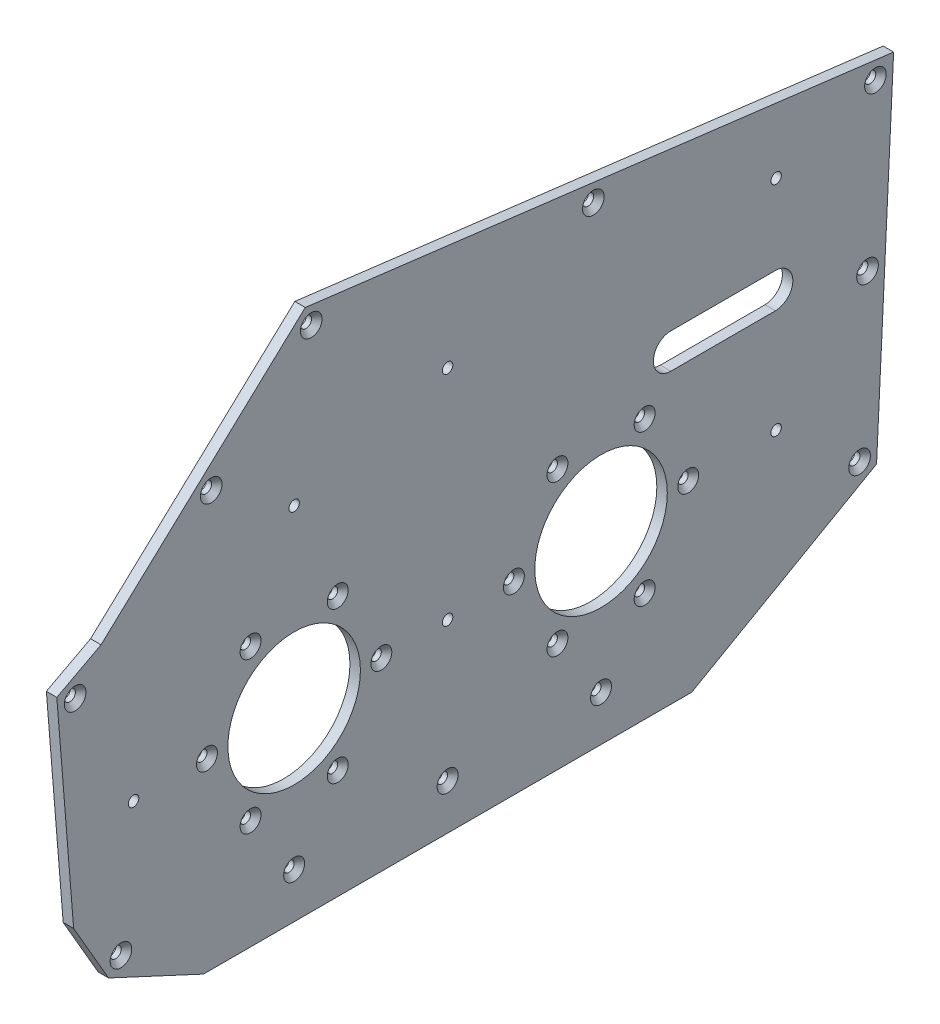
from build123d import *

# Parameters (mm, degrees)
SKETCH_1_R          = 19
SKETCH_1_R_2        = 1.5
EXTRUDE_1_DEPTH     = 3
CUT_EXTRUDE_1_DEPTH = 77
CHAMFER_1_SIZE      = 1.5
CUT_EXTRUDE_2_DEPTH = 10
SKETCH_4_R          = 1.5
CUT_EXTRUDE_3_DEPTH = 10


with BuildPart() as part:
    # 草图1 → 凸台-拉伸1 (new body)
    with BuildSketch(Plane(origin=(0, 0, 0), x_dir=(0, 0, -1), z_dir=(1, 0, 0))):
        Polygon((-82.797843441, -47.675675676), (57.202156559, -47.675675676), (110.208406204, -17.524873734), (115.106206365, 82.355112017), (-53.600732912, 103.282812317), (-112.176864092, 48.795778483), (-124.854070934, 42.075406006), (-120.030378914, -17.730379628), (-110.005365813, -35.036422282), align=None)
        with Locations((-56.797843441, 5.324324324)):
            Circle(SKETCH_1_R, mode=Mode.SUBTRACT)
        with Locations((31.202156559, 5.324324324)):
            Circle(SKETCH_1_R, mode=Mode.SUBTRACT)
        with Locations((-44.297843441, 26.974959419)):
            Circle(SKETCH_1_R_2, mode=Mode.SUBTRACT)
        with Locations((-69.297843441, 26.974959419)):
            Circle(SKETCH_1_R_2, mode=Mode.SUBTRACT)
        with Locations((-81.797843441, 5.324324324)):
            Circle(SKETCH_1_R_2, mode=Mode.SUBTRACT)
        with Locations((-69.297843441, -16.32631077)):
            Circle(SKETCH_1_R_2, mode=Mode.SUBTRACT)
        with Locations((-44.297843441, -16.32631077)):
            Circle(SKETCH_1_R_2, mode=Mode.SUBTRACT)
        with Locations((-31.797843441, 5.324324324)):
            Circle(SKETCH_1_R_2, mode=Mode.SUBTRACT)
        with Locations((43.702156559, 26.974959419)):
            Circle(SKETCH_1_R_2, mode=Mode.SUBTRACT)
        with Locations((56.202156559, 5.324324324)):
            Circle(SKETCH_1_R_2, mode=Mode.SUBTRACT)
        with Locations((43.702156559, -16.32631077)):
            Circle(SKETCH_1_R_2, mode=Mode.SUBTRACT)
        with Locations((18.702156559, -16.32631077)):
            Circle(SKETCH_1_R_2, mode=Mode.SUBTRACT)
        with Locations((6.202156559, 5.324324324)):
            Circle(SKETCH_1_R_2, mode=Mode.SUBTRACT)
        with Locations((18.702156559, 26.974959419)):
            Circle(SKETCH_1_R_2, mode=Mode.SUBTRACT)
        with Locations((-12.797843441, -34.675675676)):
            Circle(SKETCH_1_R_2, mode=Mode.SUBTRACT)
        with Locations((-56.797843441, -34.675675676)):
            Circle(SKETCH_1_R_2, mode=Mode.SUBTRACT)
        with Locations((31.202156559, -34.675675676)):
            Circle(SKETCH_1_R_2, mode=Mode.SUBTRACT)
    extrude(amount=EXTRUDE_1_DEPTH)

    # 草图2 → 切除-拉伸1 (cut)
    with BuildSketch(Plane(origin=(13, 0, 0), x_dir=(0, 0, -1), z_dir=(1, 0, 0))):
        with BuildLine():
            ThreePointArc((27.403393104, 88.196117702), (28.79425653, 86.411321094), (30.579053138, 87.80218452))
            Line((30.579053138, 87.80218452), (27.403393104, 88.196117702))
        make_face()
        with BuildLine():
            Line((27.403393104, 88.196117702), (30.579053138, 87.80218452))
            ThreePointArc((30.579053138, 87.80218452), (30.588177727, 87.900480008), (30.591223121, 87.999151111))
            ThreePointArc((30.591223121, 87.999151111), (29.089894224, 89.596105717), (27.403393104, 88.196117702))
        make_face()
        with BuildLine():
            ThreePointArc((-50.302449457, 98.033821547), (-52.487925248, 99.522854152), (-53.073972081, 96.94408087))
            Line((-53.073972081, 96.94408087), (-51.902449457, 98.033821547))
            Line((-51.902449457, 98.033821547), (-50.314619441, 97.836854955))
            ThreePointArc((-50.314619441, 97.836854955), (-50.305494851, 97.935150443), (-50.302449457, 98.033821547))
        make_face()
        with BuildLine():
            Line((-51.902449457, 98.033821547), (-53.073972081, 96.94408087))
            ThreePointArc((-53.073972081, 96.94408087), (-51.409915851, 96.51151716), (-50.314619441, 97.836854955))
            Line((-50.314619441, 97.836854955), (-51.902449457, 98.033821547))
        make_face()
        with BuildLine():
            ThreePointArc((108.297065682, 78.161447266), (108.660314483, 76.934723012), (109.806530896, 76.366400903))
            Line((109.806530896, 76.366400903), (109.884895699, 77.964480675))
            Line((109.884895699, 77.964480675), (108.297065682, 78.161447266))
        make_face()
        with BuildLine():
            Line((109.884895699, 77.964480675), (109.806530896, 76.366400903))
            ThreePointArc((109.806530896, 76.366400903), (110.988212588, 76.80573487), (111.484895699, 77.964480675))
            ThreePointArc((111.484895699, 77.964480675), (109.983566802, 79.561435281), (108.297065682, 78.161447266))
            Line((108.297065682, 78.161447266), (109.884895699, 77.964480675))
        make_face()
        with BuildLine():
            ThreePointArc((107.695276193, 33.311951388), (106.018831618, 31.792236418), (107.538546587, 30.115791844))
            Line((107.538546587, 30.115791844), (107.695276193, 33.311951388))
        make_face()
        with BuildLine():
            Line((107.695276193, 33.311951388), (107.538546587, 30.115791844))
            ThreePointArc((107.538546587, 30.115791844), (108.720228279, 30.55512581), (109.21691139, 31.713871616))
            ThreePointArc((109.21691139, 31.713871616), (108.775657196, 32.817188505), (107.695276193, 33.311951388))
        make_face()
        with BuildLine():
            ThreePointArc((105.427291884, -12.938657672), (103.985984369, -13.698652029), (103.95817557, -15.32781913))
            Line((103.95817557, -15.32781913), (105.348927081, -14.536737444))
            Line((105.348927081, -14.536737444), (105.427291884, -12.938657672))
        make_face()
        with BuildLine():
            Line((105.348927081, -14.536737444), (103.95817557, -15.32781913))
            ThreePointArc((103.95817557, -15.32781913), (105.758071055, -16.08354099), (106.948927081, -14.536737444))
            ThreePointArc((106.948927081, -14.536737444), (106.507672887, -13.433420555), (105.427291884, -12.938657672))
            Line((105.427291884, -12.938657672), (105.348927081, -14.536737444))
        make_face()
        with BuildLine():
            Line((-107.27107482, -29.781542022), (-106.469073772, -31.166025434))
            Line((-106.469073772, -31.166025434), (-105.018005912, -31.840118949))
            ThreePointArc((-105.018005912, -31.840118949), (-104.90675041, -31.511200335), (-104.869073772, -31.166025434))
            ThreePointArc((-104.869073772, -31.166025434), (-105.670074923, -29.779807256), (-107.27107482, -29.781542022))
        make_face()
        with BuildLine():
            Line((-105.018005912, -31.840118949), (-106.469073772, -31.166025434))
            Line((-106.469073772, -31.166025434), (-107.27107482, -29.781542022))
            ThreePointArc((-107.27107482, -29.781542022), (-107.548312704, -32.34722962), (-105.018005912, -31.840118949))
        make_face()
        with BuildLine():
            ThreePointArc((-118.192143373, 39.947880092), (-121.008824189, 39.967576381), (-119.477161186, 37.603662845))
            Line((-119.477161186, 37.603662845), (-119.605792973, 39.198483795))
            Line((-119.605792973, 39.198483795), (-118.192143373, 39.947880092))
        make_face()
        with BuildLine():
            Line((-119.605792973, 39.198483795), (-119.477161186, 37.603662845))
            ThreePointArc((-119.477161186, 37.603662845), (-118.429822978, 38.113543903), (-118.005792973, 39.198483795))
            ThreePointArc((-118.005792973, 39.198483795), (-118.053079323, 39.584593003), (-118.192143373, 39.947880092))
            Line((-118.192143373, 39.947880092), (-119.605792973, 39.198483795))
        make_face()
        with BuildLine():
            ThreePointArc((-79.40640478, 72.449869277), (-81.667668081, 72.531651224), (-81.749450027, 70.270387923))
            Line((-81.749450027, 70.270387923), (-79.40640478, 72.449869277))
        make_face()
        with BuildLine():
            Line((-79.40640478, 72.449869277), (-81.749450027, 70.270387923))
            ThreePointArc((-81.749450027, 70.270387923), (-79.992451614, 69.871095995), (-78.977927404, 71.3601286))
            ThreePointArc((-78.977927404, 71.3601286), (-79.088894799, 71.945604391), (-79.40640478, 72.449869277))
        make_face()
    extrude(amount=-CUT_EXTRUDE_1_DEPTH, mode=Mode.SUBTRACT)

    # 倒角1
    chamfer_1_edges = [part.edges().sort_by_distance(p)[0] for p in [
        (3, 26.974959419, 45.797843441),
        (3, 26.974959419, -42.202156559),
        (3, 72.449869277, 79.40640478),
        (3, 40.793304745, 119.73442476),
        (3, -30.49193192, 107.920141632),
        (3, -16.134817216, -105.270562278),
        (3, 30.115791844, -107.538546587),
        (3, 77.767514084, -111.472725716),
        (3, 99.123562223, 50.730926834),
        (3, -34.675675676, 14.297843441),
        (3, 88.196117702, -27.403393104),
        (3, 26.974959419, 70.797843441),
        (3, 5.324324324, 83.297843441),
        (3, -16.32631077, 70.797843441),
        (3, -16.32631077, 45.797843441),
        (3, 5.324324324, 33.297843441),
        (3, -34.675675676, 58.297843441),
        (3, 5.324324324, -54.702156559),
        (3, -16.32631077, -42.202156559),
        (3, -16.32631077, -17.202156559),
        (3, 5.324324324, -4.702156559),
        (3, 26.974959419, -17.202156559),
        (3, -34.675675676, -29.702156559),
    ]]
    chamfer(chamfer_1_edges, length=CHAMFER_1_SIZE)

    # 草图3 → 切除-拉伸2 (cut)
    with BuildSketch(Plane(origin=(3, 0, 0), x_dir=(0, 0, -1), z_dir=(1, 0, 0))):
        with BuildLine():
            Line((51.202156559, 45.049488257), (81.202156559, 45.049488257))
            ThreePointArc((81.202156559, 45.049488257), (86.202156559, 40.049488257), (81.202156559, 35.049488257))
            Line((81.202156559, 35.049488257), (51.202156559, 35.049488257))
            ThreePointArc((51.202156559, 35.049488257), (46.202156559, 40.049488257), (51.202156559, 45.049488257))
        make_face()
    extrude(amount=-CUT_EXTRUDE_2_DEPTH, mode=Mode.SUBTRACT)

    # 草图4 → 切除-拉伸3 (cut)
    with BuildSketch(Plane(origin=(3, 0, 0), x_dir=(0, 0, -1), z_dir=(1, 0, 0))):
        with BuildLine():
            ThreePointArc((-104.34833902, 5.324324324), (-102.848305768, 3.824291072), (-101.348272516, 5.324324324))
            Line((-101.348272516, 5.324324324), (-104.34833902, 5.324324324))
        make_face()
        with BuildLine():
            Line((-104.34833902, 5.324324324), (-101.348272516, 5.324324324))
            ThreePointArc((-101.348272516, 5.324324324), (-102.848305768, 6.824357576), (-104.34833902, 5.324324324))
        make_face()
        with Locations((81.407549115, 67.886412329)):
            Circle(SKETCH_4_R)
        with Locations((-56.797843441, 55.650054879)):
            Circle(SKETCH_4_R)
        with Locations((-12.797843441, 67.886412329)):
            Circle(SKETCH_4_R)
        with Locations((-12.797843441, 5.324324324)):
            Circle(SKETCH_4_R)
        with Locations((81.407549115, 5.324324324)):
            Circle(SKETCH_4_R)
    extrude(amount=-CUT_EXTRUDE_3_DEPTH, mode=Mode.SUBTRACT)


solid = part.part
